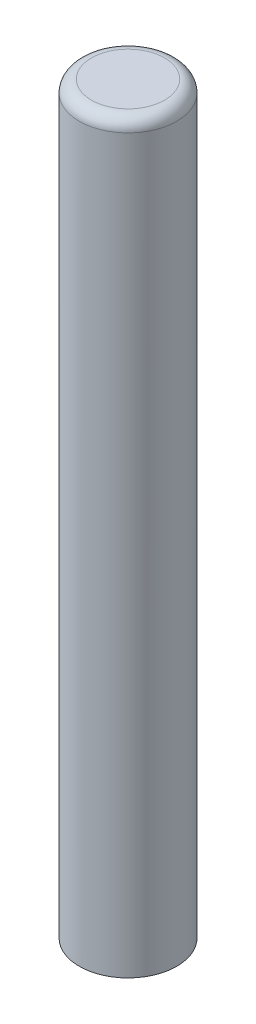
from build123d import *

# Parameters (mm, degrees)
SKETCH1_W = 4
SKETCH1_H = 61
FILLET1_R = 1


with BuildPart() as part:
    # Sketch1 → Revolve1 (revolve)
    with BuildSketch(Plane.XY, mode=Mode.PRIVATE) as revolve1_sk:
        with Locations((2, 30.5)):
            Rectangle(SKETCH1_W, SKETCH1_H)
    revolve(revolve1_sk.sketch.rotate(Axis((0, 0, 0), (0, 1, 0)), 90), axis=Axis((0, 0, 0), (0, 1, 0)))

    # Fillet1
    fillet1_edges = [part.edges().sort_by_distance(p)[0] for p in [
        (0, 61, 4),
    ]]
    fillet(fillet1_edges, radius=FILLET1_R)


solid = part.part
